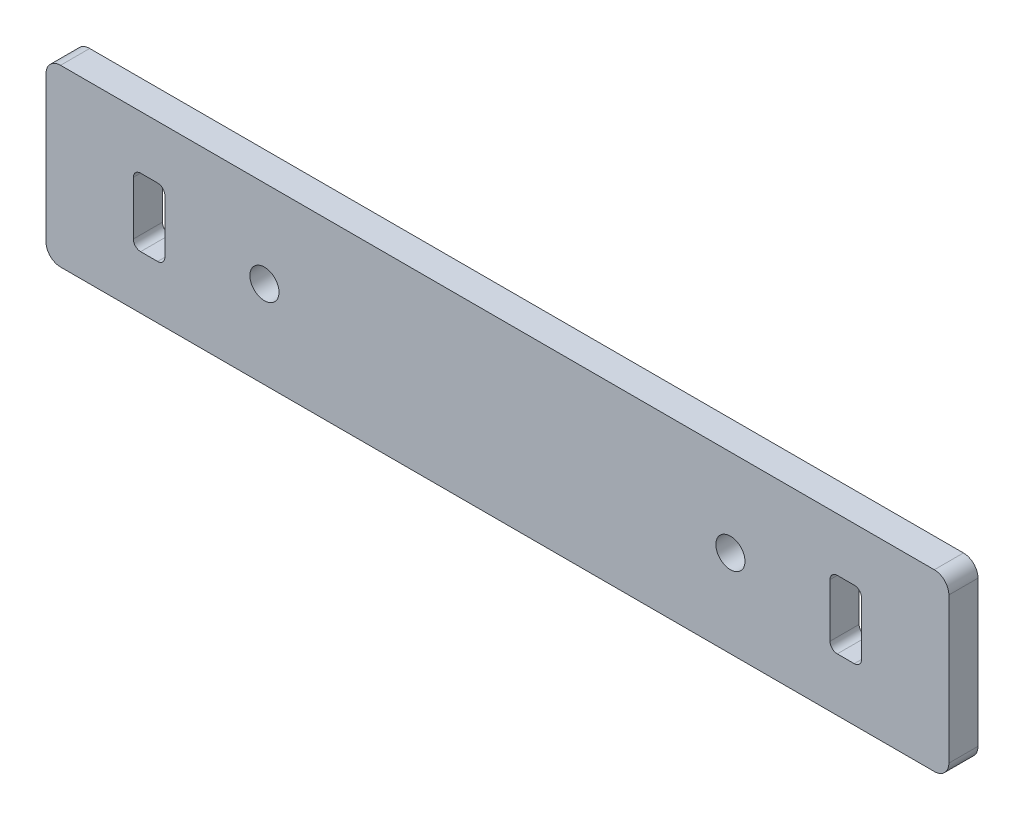
from build123d import *

# Parameters (mm, degrees)
MODEL_R                 = 1.5
SALIENTE_EXTRUIR2_DEPTH = 3


with BuildPart() as part:
    # Model → Saliente-Extruir2 (new body)
    with BuildSketch(Plane.XY):
        with BuildLine():
            Line((-1478.226934946, 336.908179756), (-1388.226934946, 336.908179756))
            ThreePointArc((-1388.226934946, 336.908179756), (-1387.166274774, 336.468839928), (-1386.726934946, 335.408179756))
            Line((-1386.726934946, 335.408179756), (-1386.726934946, 320.408179756))
            ThreePointArc((-1386.726934946, 320.408179756), (-1387.166274774, 319.347519585), (-1388.226934946, 318.908179756))
            Line((-1388.226934946, 318.908179756), (-1478.226934946, 318.908179756))
            ThreePointArc((-1478.226934946, 318.908179756), (-1479.287595118, 319.347519585), (-1479.726934946, 320.408179756))
            Line((-1479.726934946, 320.408179756), (-1479.726934946, 335.408179756))
            ThreePointArc((-1479.726934946, 335.408179756), (-1479.287595118, 336.468839928), (-1478.226934946, 336.908179756))
        make_face()
        with Locations((-1457.226934946, 327.908179756)):
            Circle(MODEL_R, mode=Mode.SUBTRACT)
        with Locations((-1409.226934946, 327.908179756)):
            Circle(MODEL_R, mode=Mode.SUBTRACT)
        with BuildLine():
            Line((-1469.981934946, 331.408179756), (-1468.231934946, 331.408179756))
            ThreePointArc((-1468.231934946, 331.408179756), (-1467.70160486, 331.188509842), (-1467.481934946, 330.658179756))
            Line((-1467.481934946, 330.658179756), (-1467.481934946, 325.158179756))
            ThreePointArc((-1467.481934946, 325.158179756), (-1467.70160486, 324.627849671), (-1468.231934946, 324.408179756))
            Line((-1468.231934946, 324.408179756), (-1469.981934946, 324.408179756))
            ThreePointArc((-1469.981934946, 324.408179756), (-1470.512265032, 324.627849671), (-1470.731934946, 325.158179756))
            Line((-1470.731934946, 325.158179756), (-1470.731934946, 330.658179756))
            ThreePointArc((-1470.731934946, 330.658179756), (-1470.512265032, 331.188509842), (-1469.981934946, 331.408179756))
        make_face(mode=Mode.SUBTRACT)
        with BuildLine():
            Line((-1398.221934946, 331.408179756), (-1396.471934946, 331.408179756))
            ThreePointArc((-1396.471934946, 331.408179756), (-1395.94160486, 331.188509842), (-1395.721934946, 330.658179756))
            Line((-1395.721934946, 330.658179756), (-1395.721934946, 325.158179756))
            ThreePointArc((-1395.721934946, 325.158179756), (-1395.94160486, 324.627849671), (-1396.471934946, 324.408179756))
            Line((-1396.471934946, 324.408179756), (-1398.221934946, 324.408179756))
            ThreePointArc((-1398.221934946, 324.408179756), (-1398.752265032, 324.627849671), (-1398.971934946, 325.158179756))
            Line((-1398.971934946, 325.158179756), (-1398.971934946, 330.658179756))
            ThreePointArc((-1398.971934946, 330.658179756), (-1398.752265032, 331.188509842), (-1398.221934946, 331.408179756))
        make_face(mode=Mode.SUBTRACT)
    extrude(amount=SALIENTE_EXTRUIR2_DEPTH)


solid = part.part
